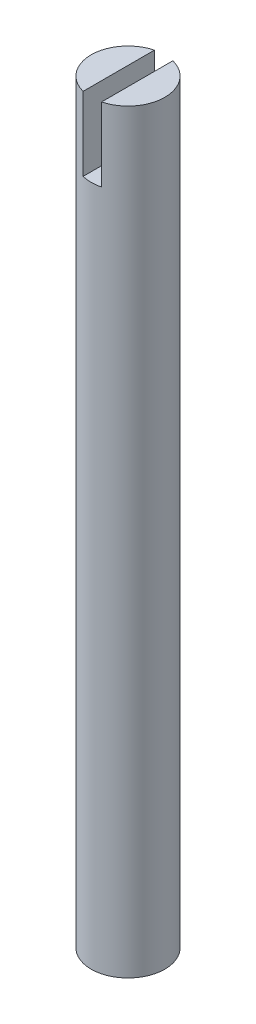
from build123d import *

# Parameters (mm, degrees)
SKETCH1_R           = 10
BOSS_EXTRUDE1_DEPTH = 205
SKETCH2_W           = 5
SKETCH2_H           = 23.07
CUT_EXTRUDE1_DEPTH  = 20


with BuildPart() as part:
    # Sketch1 → Boss-Extrude1 (new body)
    with BuildSketch(Plane(origin=(0, 0, 0), x_dir=(1, 0, 0), z_dir=(0, 1, 0))):
        with Locations(Location((0, 0, 0), (0, 0, 90))):
            Circle(SKETCH1_R)
    extrude(amount=BOSS_EXTRUDE1_DEPTH)

    # Sketch2 → Cut-Extrude1 (cut)
    with BuildSketch(Plane(origin=(0, 205, 0), x_dir=(1, 0, 0), z_dir=(0, 1, 0))):
        Rectangle(SKETCH2_W, SKETCH2_H)
    extrude(amount=-CUT_EXTRUDE1_DEPTH, mode=Mode.SUBTRACT)


solid = part.part
